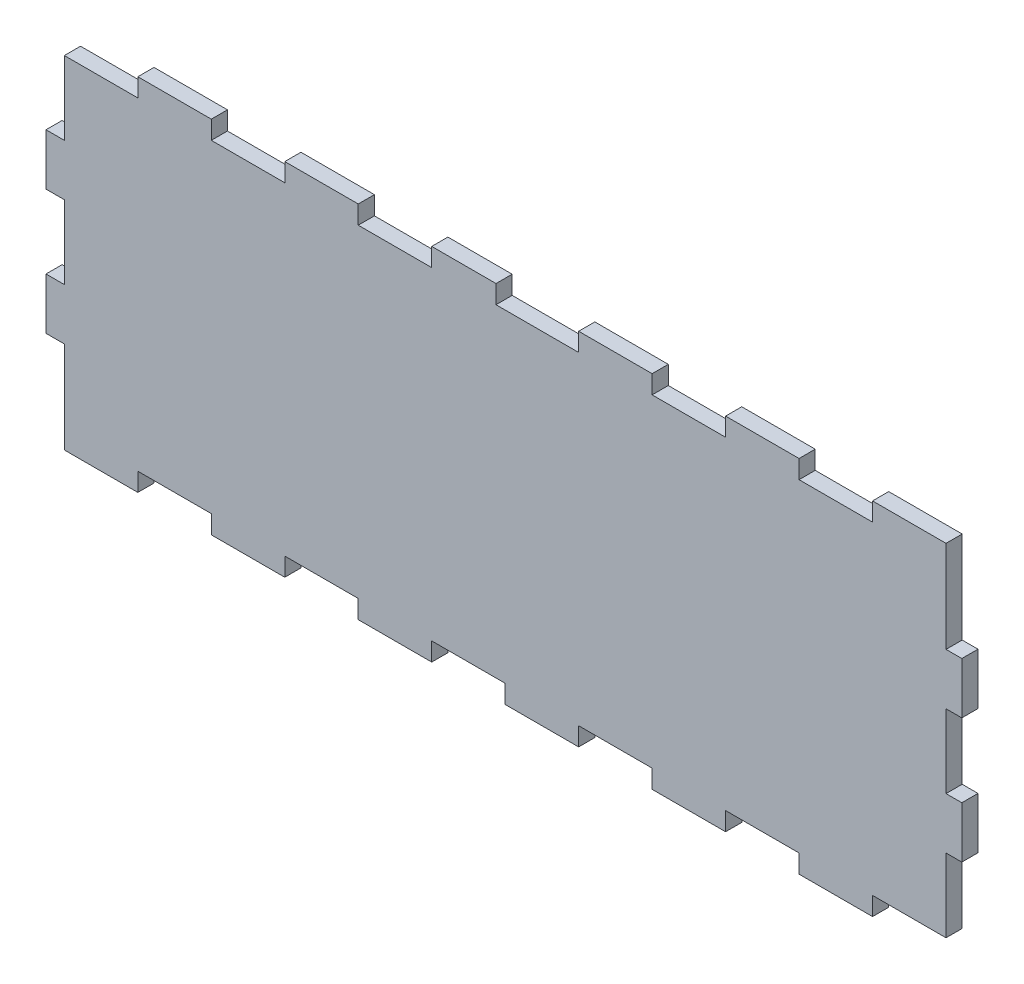
from build123d import *

# Parameters (mm, degrees)
BOSS_EXTRUDE1_DEPTH = 5.588


with BuildPart() as part:
    # Sketch1 → Boss-Extrude1 (new body)
    with BuildSketch(Plane(origin=(-5.329574036, -16.20301374, 0), x_dir=(1, 0, 0), z_dir=(0, 0, 1))):
        Polygon((-288.637525151, -72.531124316), (-294.987525151, -72.531124316), (-294.987525151, -90.311124316), (-288.637525151, -90.311124316), (-288.637525151, -115.711124316), (-294.987525151, -115.711124316), (-294.987525151, -133.491124316), (-288.637525151, -133.491124316), (-288.637525151, -165.241124316), (-263.237525151, -165.241124316), (-263.237525151, -158.891124316), (-237.837525151, -158.891124316), (-237.837525151, -165.241124316), (-212.437525151, -165.241124316), (-212.437525151, -158.891124316), (-187.037525151, -158.891124316), (-187.037525151, -165.241124316), (-161.637525151, -165.241124316), (-161.637525151, -158.891124316), (-136.237525151, -158.891124316), (-136.237525151, -165.241124316), (-110.837525151, -165.241124316), (-110.837525151, -158.891124316), (-85.437525151, -158.891124316), (-85.437525151, -165.241124316), (-60.037525151, -165.241124316), (-60.037525151, -158.891124316), (-34.637525151, -158.891124316), (-34.637525151, -165.241124316), (-9.237525151, -165.241124316), (-9.237525151, -158.891124316), (16.162474849, -158.891124316), (16.162474849, -133.491124316), (21.632687755, -133.491124316), (21.632687755, -115.711124316), (16.162474849, -115.711124316), (16.162474849, -90.311124316), (21.632687755, -90.311124316), (21.632687755, -72.531124316), (16.162474849, -72.531124316), (16.162474849, -40.781124316), (-9.237525151, -40.781124316), (-9.237525151, -47.131124316), (-34.637525151, -47.131124316), (-34.637525151, -40.781124316), (-60.037525151, -40.781124316), (-60.037525151, -47.131124316), (-85.437525151, -47.131124316), (-85.437525151, -40.781124316), (-110.837525151, -40.781124316), (-110.837525151, -47.131124316), (-139.412525151, -47.131124316), (-139.412525151, -40.781124316), (-161.637525151, -40.781124316), (-161.637525151, -47.131124316), (-187.037525151, -47.131124316), (-187.037525151, -40.781124316), (-212.437525151, -40.781124316), (-212.437525151, -47.131124316), (-237.837525151, -47.131124316), (-237.837525151, -40.781124316), (-263.237525151, -40.781124316), (-263.237525151, -47.131124316), (-288.637525151, -47.131124316), align=None)
    extrude(amount=BOSS_EXTRUDE1_DEPTH)


solid = part.part
